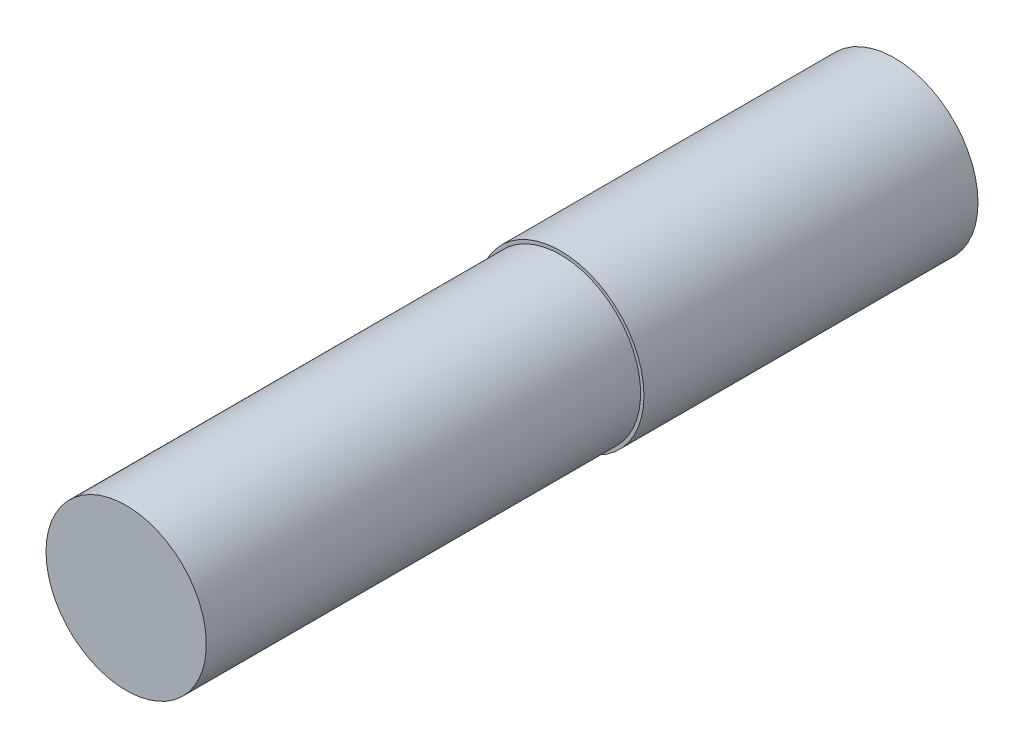
from build123d import *

# Parameters (mm, degrees)
ESQUISSE1_R        = 2.5
BOSS_EXTRU_1_DEPTH = 10
ESQUISSE2_R        = 2.4
BOSS_EXTRU_2_DEPTH = 13


with BuildPart() as part:
    # Esquisse1 → Boss.-Extru.1 (new body)
    with BuildSketch(Plane.XY):
        Circle(ESQUISSE1_R)
    extrude(amount=BOSS_EXTRU_1_DEPTH)

    # Esquisse2 → Boss.-Extru.2 (add)
    with BuildSketch(Plane.XY.offset(10)):
        with Locations(Location((0, 0, 0), (0, 0, 180))):
            Circle(ESQUISSE2_R)
    extrude(amount=BOSS_EXTRU_2_DEPTH)


solid = part.part
